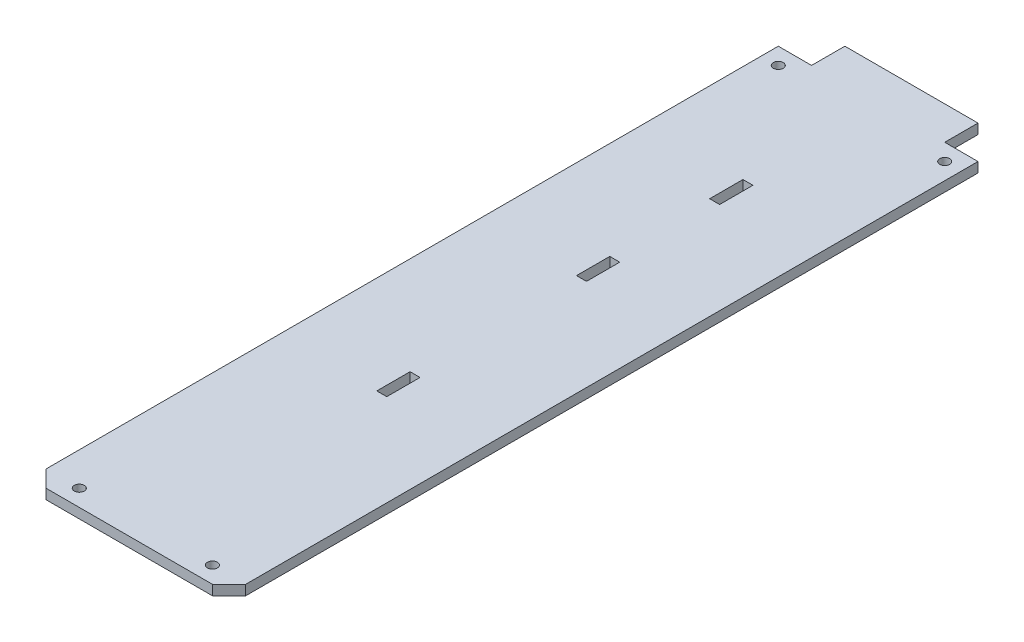
from build123d import *

# Parameters (mm, degrees)
BOSS_EXTRUDE1_DEPTH = 3
SKETCH2_R           = 1.5
SKETCH2_W           = 3
SKETCH2_H           = 10
CUT_EXTRUDE1_DEPTH  = 25
CHAMFER1_SIZE       = 5


with BuildPart() as part:
    # Sketch1 → Boss-Extrude1 (new body)
    with BuildSketch(Plane(origin=(0, 0, 0), x_dir=(1, 0, 0), z_dir=(0, 1, 0))):
        Polygon((19.120621977, 112.5), (29.120621977, 112.5), (29.120621977, -112.5), (-30.879378023, -112.5), (-30.879378023, 112.5), (-20.879378023, 112.5), (-20.879378023, 122.5), (19.120621977, 122.5), align=None)
    extrude(amount=BOSS_EXTRUDE1_DEPTH)

    # Sketch2 → Cut-Extrude1 (cut)
    with BuildSketch(Plane(origin=(0, 3, 0), x_dir=(1, 0, 0), z_dir=(0, 1, 0))):
        with Locations(Location((24.120621977, 107.5, 0), (0, 0, 270))):
            Circle(SKETCH2_R)
        with Locations(Location((-25.879378023, 107.5, 0), (0, 0, 270))):
            Circle(SKETCH2_R)
        with Locations(Location((-20.879378023, -107.5, 0), (0, 0, 270))):
            Circle(SKETCH2_R)
        with Locations(Location((19.120621977, -107.5, 0), (0, 0, 270))):
            Circle(SKETCH2_R)
        with Locations((0, 67.5)):
            Rectangle(SKETCH2_W, SKETCH2_H)
        with Locations((0, -32.5)):
            Rectangle(SKETCH2_W, SKETCH2_H)
        with Locations((0, 27.5)):
            Rectangle(SKETCH2_W, SKETCH2_H)
    extrude(amount=-CUT_EXTRUDE1_DEPTH, mode=Mode.SUBTRACT)

    # Chamfer1
    chamfer1_edges = [part.edges().sort_by_distance(p)[0] for p in [
        (29.120621977, 1.5, 112.5),
        (-30.879378023, 1.5, 112.5),
    ]]
    chamfer(chamfer1_edges, length=CHAMFER1_SIZE)


solid = part.part
